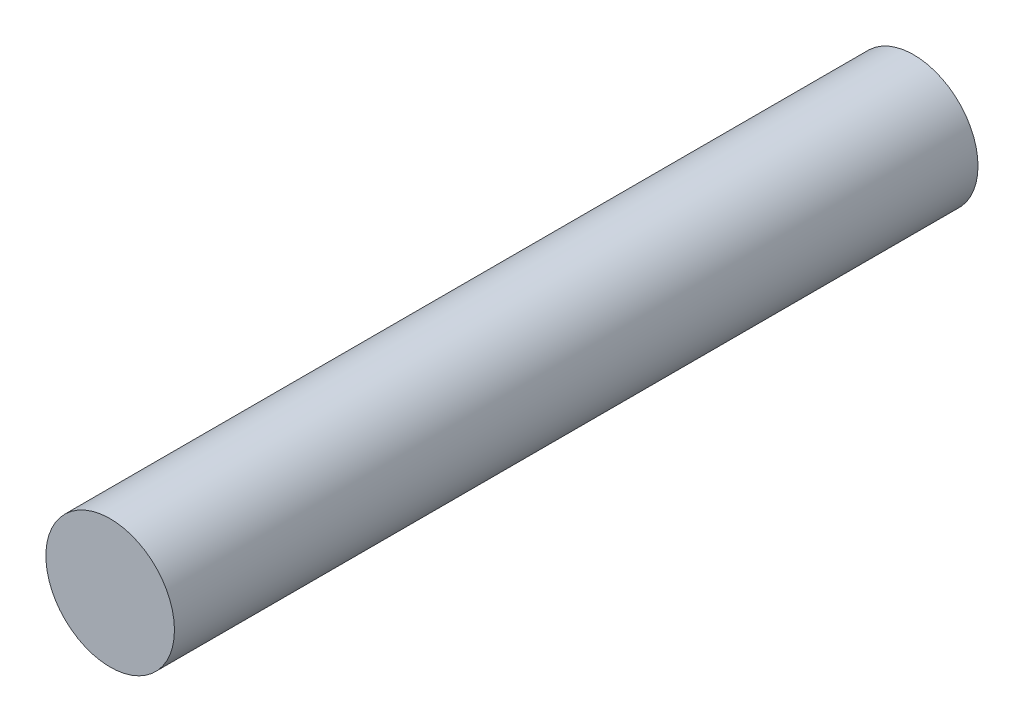
from build123d import *

# Parameters (mm, degrees)
SKETCH1_R           = 8
BOSS_EXTRUDE1_DEPTH = 50


with BuildPart() as part:
    # Sketch1 → Boss-Extrude1 (new, symmetric)
    with BuildSketch(Plane.XY):
        Circle(SKETCH1_R)
    extrude(amount=BOSS_EXTRUDE1_DEPTH, both=True)


solid = part.part
